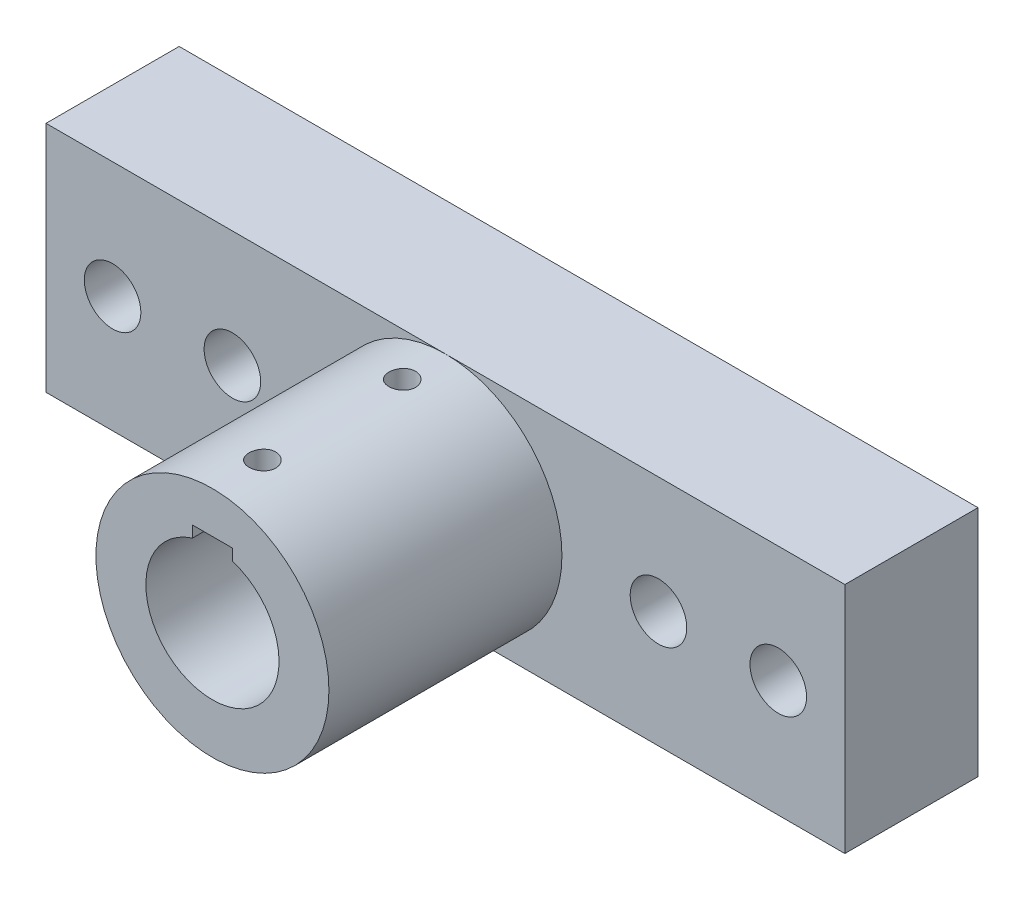
from build123d import *

# Parameters (mm, degrees)
BOSS_EXTRUDE1_DEPTH = 35
CUT_EXTRUDE1_DEPTH  = 89.600225733
SKETCH3_R           = 4.25
CUT_EXTRUDE2_DEPTH  = 78.781745931
CUT_EXTRUDE6_DEPTH  = 35
CUT_EXTRUDE7_REACH  = 82.156
SKETCH5_R           = 2


with BuildPart() as part:
    # Sketch1 → Boss-Extrude1 (new body)
    with BuildSketch(Plane(origin=(0, 0, 0), x_dir=(1, 0, 0), z_dir=(0, 1, 0))):
        Polygon((-60, 15), (60, 15), (60, -5), (17.5, -5), (17.5, -40), (-17.5, -40), (-17.5, -5), (-60, -5), align=None)
    extrude(amount=BOSS_EXTRUDE1_DEPTH)

    # Sketch2 → Cut-Extrude1 (cut, through all)
    with BuildSketch(Plane.XY.offset(40)):
        with BuildLine():
            Line((3, 28.75), (-3, 28.75))
            Line((-3, 28.75), (-3, 27.039392014))
            ThreePointArc((-3, 27.039392014), (0, 27.5), (3, 27.039392014))
            Line((3, 27.039392014), (3, 28.75))
        make_face()
        with BuildLine():
            ThreePointArc((3, 27.039392014), (0, 27.5), (-3, 27.039392014))
            Line((-3, 27.039392014), (3, 27.039392014))
        make_face()
        with BuildLine():
            Line((3, 27.039392014), (-3, 27.039392014))
            ThreePointArc((-3, 27.039392014), (-5.916079783, 9.437742252), (10, 17.5))
            ThreePointArc((10, 17.5), (8.062257748, 23.416079783), (3, 27.039392014))
        make_face()
    extrude(amount=-CUT_EXTRUDE1_DEPTH, mode=Mode.SUBTRACT)

    # Sketch3 → Cut-Extrude2 (cut, through all)
    with BuildSketch(Plane.XY.offset(5)):
        with Locations((-50, 17.5)):
            Circle(SKETCH3_R)
        with Locations((-32, 17.5)):
            Circle(SKETCH3_R)
        with Locations(Location((32, 17.5, 0), (0, 0, 180))):
            Circle(SKETCH3_R)
        with Locations(Location((50, 17.5, 0), (0, 0, 180))):
            Circle(SKETCH3_R)
    extrude(amount=-CUT_EXTRUDE2_DEPTH, mode=Mode.SUBTRACT)

    # Sketch4 → Cut-Extrude6 (cut)
    with BuildSketch(Plane.XY.offset(40)):
        with BuildLine():
            Line((0, 35), (-17.5, 35))
            Line((-17.5, 35), (-17.5, 17.5))
            ThreePointArc((-17.5, 17.5), (-12.374368671, 29.874368671), (0, 35))
        make_face()
        with BuildLine():
            Line((17.5, 35), (0, 35))
            ThreePointArc((0, 35), (12.374368671, 29.874368671), (17.5, 17.5))
            Line((17.5, 17.5), (17.5, 35))
        make_face()
        with BuildLine():
            Line((17.5, 0), (17.5, 17.5))
            ThreePointArc((17.5, 17.5), (12.374368681, 5.12563134), (3e-08, 0))
            Line((3e-08, 0), (17.5, 0))
        make_face()
        with BuildLine():
            ThreePointArc((3e-08, 0), (-12.37436866, 5.125631319), (-17.5, 17.5))
            Line((-17.5, 17.5), (-17.5, 0))
            Line((-17.5, 0), (3e-08, 0))
        make_face()
    extrude(amount=-CUT_EXTRUDE6_DEPTH, mode=Mode.SUBTRACT)

    # Sketch5 → Cut-Extrude7 (cut, up to next)
    with BuildSketch(Plane(origin=(0, 35, 0), x_dir=(1, 0, 0), z_dir=(0, 1, 0)), mode=Mode.PRIVATE) as cut_extrude7_sk1:
        with Locations(Location((0, -32.5, 0), (0, 0, 270))):
            Circle(SKETCH5_R)
    cut_extrude7_tool1 = extrude(cut_extrude7_sk1.sketch, amount=-CUT_EXTRUDE7_REACH, mode=Mode.PRIVATE) & part.part
    # Sketch5 → Cut-Extrude7 (cut, up to next)
    with BuildSketch(Plane(origin=(0, 35, 0), x_dir=(1, 0, 0), z_dir=(0, 1, 0)), mode=Mode.PRIVATE) as cut_extrude7_sk2:
        with Locations(Location((0, -11.5, 0), (0, 0, 270))):
            Circle(SKETCH5_R)
    cut_extrude7_tool2 = extrude(cut_extrude7_sk2.sketch, amount=-CUT_EXTRUDE7_REACH, mode=Mode.PRIVATE) & part.part
    add(cut_extrude7_tool1.solids().sort_by_distance((0, 35, 32.5))[0], mode=Mode.SUBTRACT)
    add(cut_extrude7_tool2.solids().sort_by_distance((0, 35, 11.5))[0], mode=Mode.SUBTRACT)


solid = part.part
